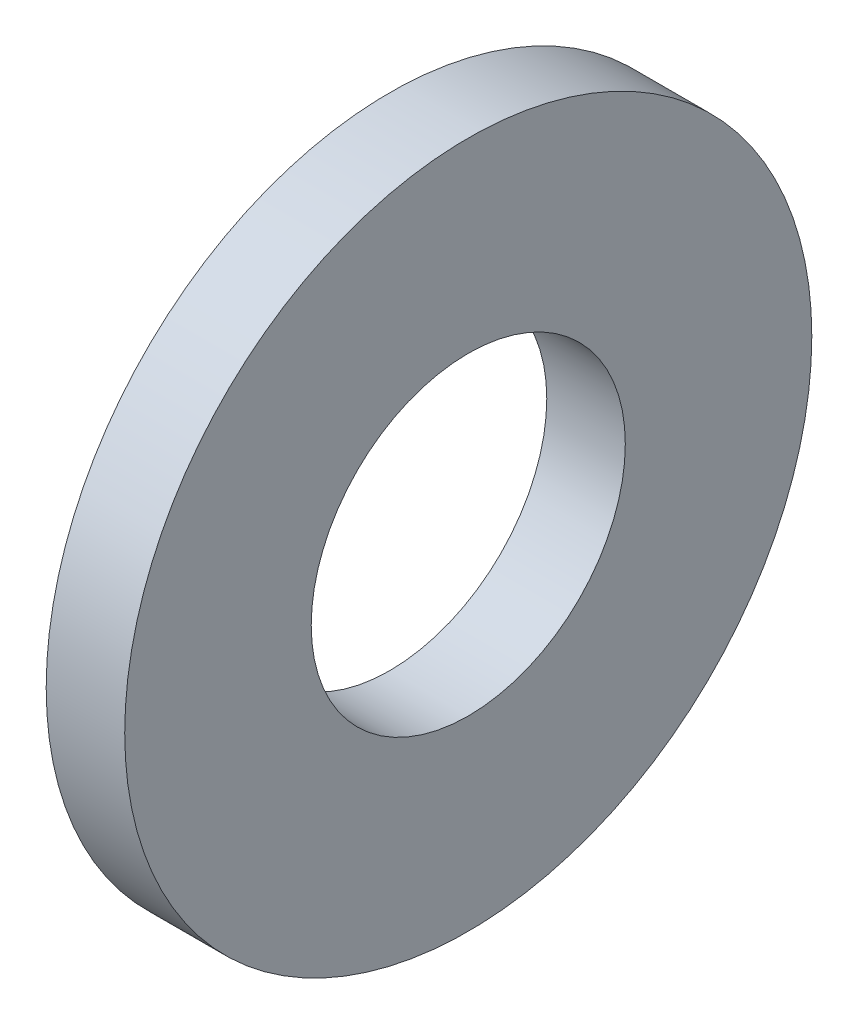
from build123d import *

# Parameters (mm, degrees)
SKETCH1_R          = 3.5
SKETCH1_R_2        = 1.6
BASE_EXTRUDE_DEPTH = 0.8


with BuildPart() as part:
    # Sketch1 → Base-Extrude (new body)
    with BuildSketch(Plane(origin=(0, 0, 0), x_dir=(0, 0, -1), z_dir=(1, 0, 0))):
        Circle(SKETCH1_R)
        Circle(SKETCH1_R_2, mode=Mode.SUBTRACT)
    extrude(amount=BASE_EXTRUDE_DEPTH)


solid = part.part
